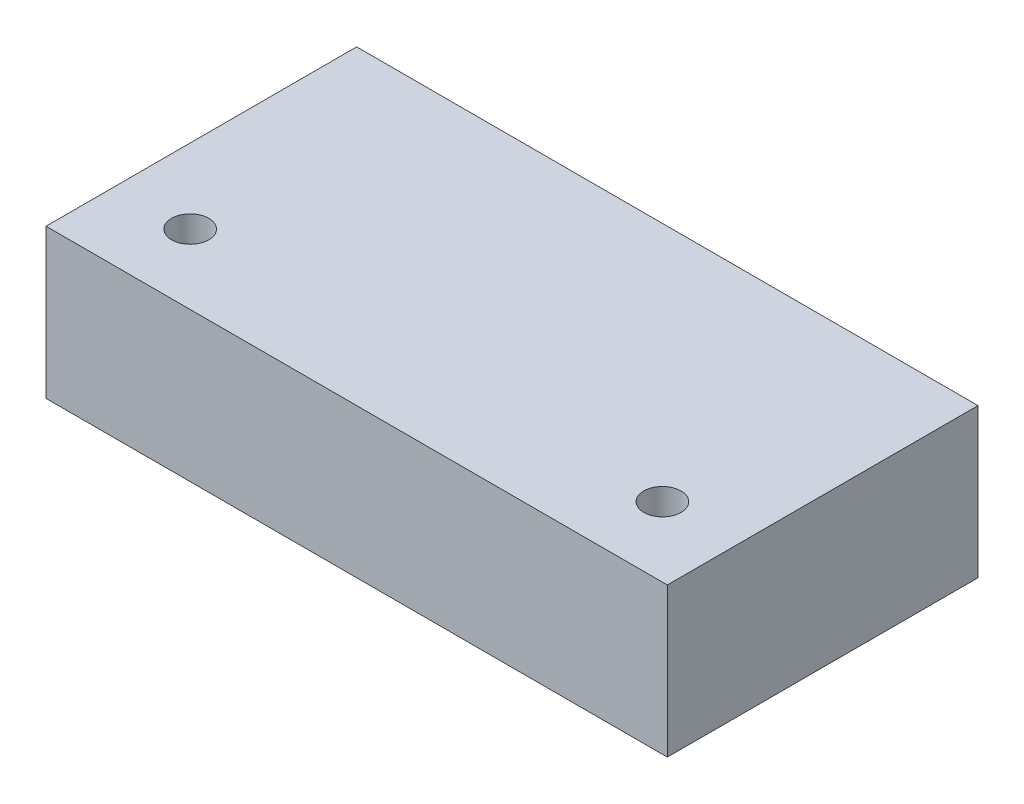
from build123d import *

# Parameters (mm, degrees)
SKETCH1_W           = 50
SKETCH1_H           = 12
BOSS_EXTRUDE1_DEPTH = 25
CUT_EXTRUDE1_REACH  = 39.336
SKETCH2_R           = 1.5


with BuildPart() as part:
    # Sketch1 → Boss-Extrude1 (new body)
    with BuildSketch(Plane.XY):
        Rectangle(SKETCH1_W, SKETCH1_H)
    extrude(amount=BOSS_EXTRUDE1_DEPTH)

    # Sketch2 → Cut-Extrude1 (cut, up to next)
    with BuildSketch(Plane.XZ.offset(6), mode=Mode.PRIVATE) as cut_extrude1_sk1:
        with Locations(Location((-19, 19.395863619, 0), (0, 0, 270))):
            Circle(SKETCH2_R)
    cut_extrude1_tool1 = extrude(cut_extrude1_sk1.sketch, amount=-CUT_EXTRUDE1_REACH, mode=Mode.PRIVATE) & part.part
    # Sketch2 → Cut-Extrude1 (cut, up to next)
    with BuildSketch(Plane.XZ.offset(6), mode=Mode.PRIVATE) as cut_extrude1_sk2:
        with Locations(Location((19, 19.395863619, 0), (0, 0, 270))):
            Circle(SKETCH2_R)
    cut_extrude1_tool2 = extrude(cut_extrude1_sk2.sketch, amount=-CUT_EXTRUDE1_REACH, mode=Mode.PRIVATE) & part.part
    add(cut_extrude1_tool1.solids().sort_by_distance((-19, -6, 19.395864))[0], mode=Mode.SUBTRACT)
    add(cut_extrude1_tool2.solids().sort_by_distance((19, -6, 19.395864))[0], mode=Mode.SUBTRACT)


solid = part.part
